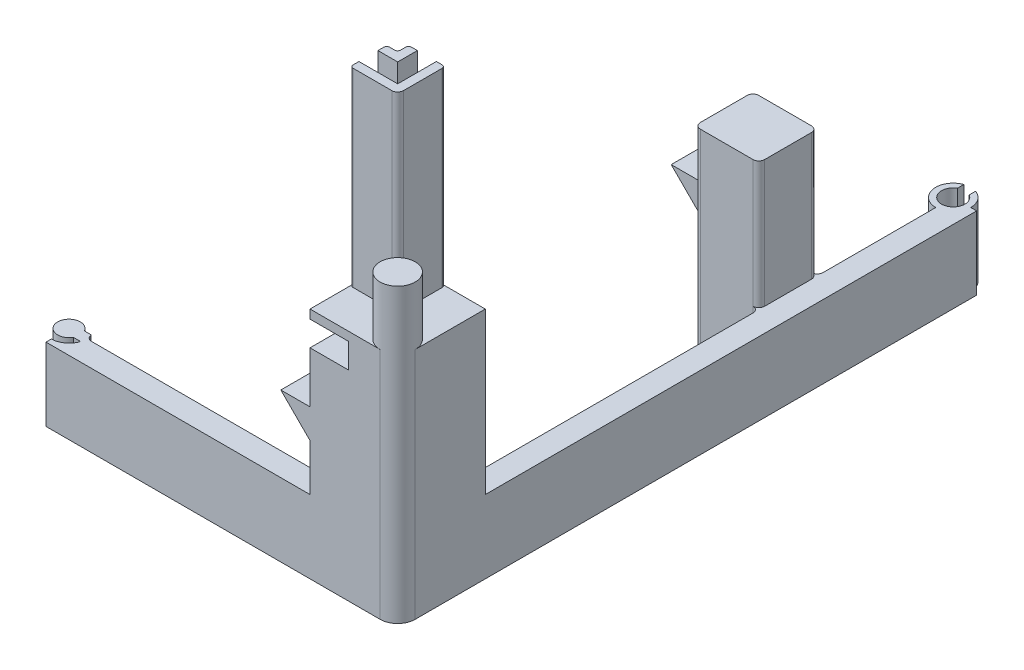
from build123d import *

# Parameters (mm, degrees)
SKETCH1_W                 = 30
SKETCH1_H                 = 30
BOSS_EXTRUDE1_DEPTH       = 80
SKETCH2_R                 = 6
BOSS_EXTRUDE2_DEPTH       = 20
CUT_EXTRUDE1_DEPTH        = 83.764726786
BOSS_EXTRUDE3_DEPTH       = 65
BOSS_EXTRUDE5_DEPTH       = 2
BOSS_EXTRUDE6_DEPTH       = 23
BOSS_EXTRUDE7_DEPTH       = 25
FILLET1_R                 = 2
SKETCH11_R                = 6.055782361
CUT_EXTRUDE2_DEPTH        = 2.125
CUT_EXTRUDE4_DEPTH        = 274.267856233
CUT_EXTRUDE4_DEPTH_BACK   = 274.267856233
SKETCH13_W                = 13.25
SKETCH13_H                = 8.5
FILLET2_R                 = 2
CUT_EXTRUDE6_REACH        = 234.702
SKETCH16_W                = 3.75
SKETCH16_H                = 3.75
FILLET4_R                 = 1
BOSS_EXTRUDE8_REACH       = 264.25
SKETCH17_W                = 22
SKETCH17_H                = 20
SKETCH18_W                = 17
SKETCH18_H                = 15
CUT_EXTRUDE7_DEPTH        = 66
FILLET5_R                 = 2
FILLET6_R                 = 2
CHAMFER1_SIZE             = 7
BOSS_EXTRUDE9_DEPTH       = 30
BOSS_EXTRUDE10_DEPTH      = 8
BOSS_EXTRUDE10_DEPTH_BACK = 8


with BuildPart() as part:
    # Sketch1 → Boss-Extrude1 (new body)
    with BuildSketch(Plane(origin=(0, 0, 0), x_dir=(1, 0, 0), z_dir=(0, 1, 0))):
        Rectangle(SKETCH1_W, SKETCH1_H)
    extrude(amount=BOSS_EXTRUDE1_DEPTH)

    # Sketch2 → Boss-Extrude2 (add)
    with BuildSketch(Plane(origin=(0, 80, 0), x_dir=(1, 0, 0), z_dir=(0, 1, 0))):
        with Locations(Location((9, -9, 0), (0, 0, 270))):
            Circle(SKETCH2_R)
    extrude(amount=BOSS_EXTRUDE2_DEPTH)

    # Sketch3 → Cut-Extrude1 (cut, through all)
    with BuildSketch(Plane(origin=(0, 80, 0), x_dir=(1, 0, 0), z_dir=(0, 1, 0))):
        with BuildLine():
            Line((9, -15), (15, -15))
            Line((15, -15), (15, -9))
            ThreePointArc((15, -9), (13.242640687, -13.242640687), (9, -15))
        make_face()
    extrude(amount=-CUT_EXTRUDE1_DEPTH, mode=Mode.SUBTRACT)

    # Sketch4 → Boss-Extrude3 (add)
    with BuildSketch(Plane(origin=(0, 80, 0), x_dir=(1, 0, 0), z_dir=(0, 1, 0))):
        Polygon((-11.25, 1.75), (-1.75, 1.75), (-1.75, 11.25), (-1.75, 15), (1.25, 15), (1.25, 11.25), (1.25, -1.25), (-11.25, -1.25), (-15, -1.25), (-15, 1.75), align=None)
        Polygon((-11.25, 8.25), (-8.25, 8.25), (-8.25, 11.25), (-8.25, 15), (-11.25, 15), (-11.25, 11.25), (-15, 11.25), (-15, 8.25), align=None)
    extrude(amount=BOSS_EXTRUDE3_DEPTH)

    # Sketch6 → Boss-Extrude5 (add)
    with BuildSketch(Plane.XZ):
        with BuildLine():
            Line((15, -15), (7, -15))
            Line((7, -15), (7, -177.175))
            ThreePointArc((7, -177.175), (2.757359313, -187.417640687), (13, -183.175))
            Line((13, -183.175), (15, -183.175))
            Line((15, -183.175), (15, -15))
        make_face()
    extrude(amount=-BOSS_EXTRUDE5_DEPTH)

    # Sketch7 → Boss-Extrude6 (add)
    with BuildSketch(Plane(origin=(0, 2, 0), x_dir=(1, 0, 0), z_dir=(0, 1, 0))):
        with BuildLine():
            Line((9, 188.831854249), (9, 186.639101615))
            ThreePointArc((9, 186.639101615), (7, 179.175), (5, 186.639101615))
            Line((5, 186.639101615), (5, 188.831854249))
            ThreePointArc((5, 188.831854249), (1.086408642, 182.160388128), (7, 177.175))
            Line((7, 177.175), (7, 15))
            Line((7, 15), (15, 15))
            Line((15, 15), (15, 183.175))
            Line((15, 183.175), (13, 183.175))
            ThreePointArc((13, 183.175), (11.898979486, 186.639101615), (9, 188.831854249))
        make_face()
    extrude(amount=BOSS_EXTRUDE6_DEPTH)

    # Sketch9 → Boss-Extrude7 (add)
    with BuildSketch(Plane.XZ):
        with BuildLine():
            Line((-15, 15), (-15, 7))
            Line((-15, 7), (-99.5, 7))
            ThreePointArc((-99.5, 7), (-99.577697751, 6.037536458), (-99.80877869, 5.1))
            Line((-99.80877869, 5.1), (-102.122778509, 5.1))
            ThreePointArc((-102.122778509, 5.1), (-109.375, 7), (-102.122778509, 8.9))
            Line((-102.122778509, 8.9), (-99.625, 8.9))
            ThreePointArc((-99.625, 8.9), (-101.816885554, 11.955834237), (-105.375001601, 13.173329766))
            Line((-105.375001601, 13.173329766), (-105.375001601, 15))
            Line((-105.375001601, 15), (-15, 15))
        make_face()
    extrude(amount=-BOSS_EXTRUDE7_DEPTH)

    # Fillet1
    fillet1_edges = [part.edges().sort_by_distance(p)[0] for p in [
        (-99.5, 12.5, 7),
    ]]
    fillet(fillet1_edges, radius=FILLET1_R)

    # Sketch11 → Cut-Extrude2 (cut)
    with BuildSketch(Plane.XZ):
        with Locations((-105.5, 7)):
            Circle(SKETCH11_R)
    extrude(amount=-CUT_EXTRUDE2_DEPTH, mode=Mode.SUBTRACT)

    # Sketch13 → Cut-Extrude4 (cut, two sides: drawn at the far end of the back side and taken through both)
    with BuildSketch(Plane.XY.offset(15).offset(-CUT_EXTRUDE4_DEPTH_BACK)):
        with Locations((-8.375, 72.75)):
            Rectangle(SKETCH13_W, SKETCH13_H)
    extrude(amount=CUT_EXTRUDE4_DEPTH + CUT_EXTRUDE4_DEPTH_BACK, mode=Mode.SUBTRACT)

    # Fillet2
    fillet2_edges = [part.edges().sort_by_distance(p)[0] for p in [
        (1.25, 112.5, 1.25),
    ]]
    fillet(fillet2_edges, radius=FILLET2_R)

    # Sketch16 → Cut-Extrude6 (cut, up to next)
    with BuildSketch(Plane(origin=(0, 80, 0), x_dir=(1, 0, 0), z_dir=(0, 1, 0)), mode=Mode.PRIVATE) as cut_extrude6_sk1:
        with Locations((-13.125, 13.125)):
            Rectangle(SKETCH16_W, SKETCH16_H)
    cut_extrude6_tool1 = extrude(cut_extrude6_sk1.sketch, amount=-CUT_EXTRUDE6_REACH, mode=Mode.PRIVATE) & part.part
    add(cut_extrude6_tool1.solids().sort_by_distance((-13.125, 80, -13.125))[0], mode=Mode.SUBTRACT)

    # Fillet4
    fillet4_edges = [part.edges().sort_by_distance(p)[0] for p in [
        (-11.25, 111, -11.25),
        (-15, 111, -11.25),
        (-11.25, 111, -15),
        (-15, 112.5, 1.25),
        (1.25, 112.5, -15),
    ]]
    fillet(fillet4_edges, radius=FILLET4_R)

    # Boss-Extrude8: up to this face of the body (flat: up to its plane)
    boss_extrude8_end = Plane(part.part.faces().sort_by_distance((-8.375, 68.5, 0))[0])
    # Sketch17 → Boss-Extrude8 (add, up to the picked face)
    with BuildSketch(Plane.XZ, mode=Mode.PRIVATE) as boss_extrude8_sk1:
        with Locations((-4, -126.63125)):
            Rectangle(SKETCH17_W, SKETCH17_H)
    boss_extrude8_tool1 = split(extrude(boss_extrude8_sk1.sketch, amount=-BOSS_EXTRUDE8_REACH, mode=Mode.PRIVATE), bisect_by=boss_extrude8_end, keep=Keep.BOTH, mode=Mode.PRIVATE)
    add(boss_extrude8_tool1.solids().sort_by(Axis((-4, 0, -126.63125), (0, 1, 0)))[0])

    # Sketch18 → Cut-Extrude7 (cut)
    with BuildSketch(Plane.XZ):
        with Locations((-4, -126.63125)):
            Rectangle(SKETCH18_W, SKETCH18_H)
    extrude(amount=-CUT_EXTRUDE7_DEPTH, mode=Mode.SUBTRACT)

    # Fillet5
    fillet5_edges = [part.edges().sort_by_distance(p)[0] for p in [
        (7, 12.5, -116.63125),
        (7, 12.5, -136.63125),
        (-15, 34.25, -136.63125),
        (-15, 34.25, -116.63125),
    ]]
    fillet(fillet5_edges, radius=FILLET5_R)

    # Fillet6
    fillet6_edges = [part.edges().sort_by_distance(p)[0] for p in [
        (7, 46.75, -116.63125),
        (7, 46.75, -136.63125),
    ]]
    fillet(fillet6_edges, radius=FILLET6_R)

    # Chamfer1
    chamfer1_edges = [part.edges().sort_by_distance(p)[0] for p in [
        (-12.5, 66, -126.63125),
        (-4, 66, -119.13125),
        (4.5, 66, -126.63125),
        (-4, 66, -134.13125),
    ]]
    chamfer(chamfer1_edges, length=CHAMFER1_SIZE)

    # Sketch19 → Boss-Extrude9 (add)
    with BuildSketch(Plane.XY.offset(15)):
        Polygon((-15, 51), (-25, 51), (-15, 41), align=None)
    extrude(amount=-BOSS_EXTRUDE9_DEPTH)

    # Sketch20 → Boss-Extrude10 (add, two sides: drawn at the far end of the back side and taken through both)
    with BuildSketch(Plane(origin=(0, 0, -126.63125), x_dir=(-1, 0, 0), z_dir=(0, 0, -1)).offset(-BOSS_EXTRUDE10_DEPTH_BACK)):
        Polygon((25, 51), (15, 51), (15, 41), align=None)
    extrude(amount=BOSS_EXTRUDE10_DEPTH + BOSS_EXTRUDE10_DEPTH_BACK)


solid = part.part
